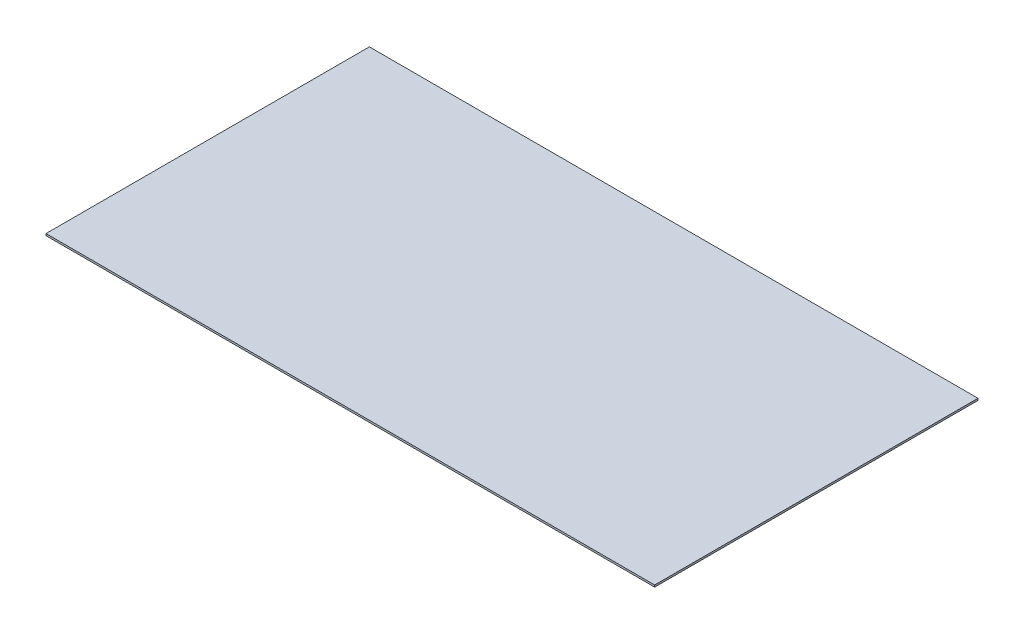
from build123d import *

# Parameters (mm, degrees)
SKETCH1_W           = 406.4
SKETCH1_H           = 254
SKETCH1_H_2         = 177.8
BOSS_EXTRUDE1_DEPTH = 2.54


with BuildPart() as part:
    # Sketch1 → Boss-Extrude1 (new body)
    with BuildSketch(Plane(origin=(0, 0, 0), x_dir=(1, 0, 0), z_dir=(0, 1, 0))):
        with Locations((203.2, 127)):
            Rectangle(SKETCH1_W, SKETCH1_H)
        with Locations((203.2, 342.9)):
            Rectangle(SKETCH1_W, SKETCH1_H_2)
        with Locations((609.6, 342.9)):
            Rectangle(SKETCH1_W, SKETCH1_H_2)
        with Locations((609.6, 127)):
            Rectangle(SKETCH1_W, SKETCH1_H)
    extrude(amount=BOSS_EXTRUDE1_DEPTH)


solid = part.part
